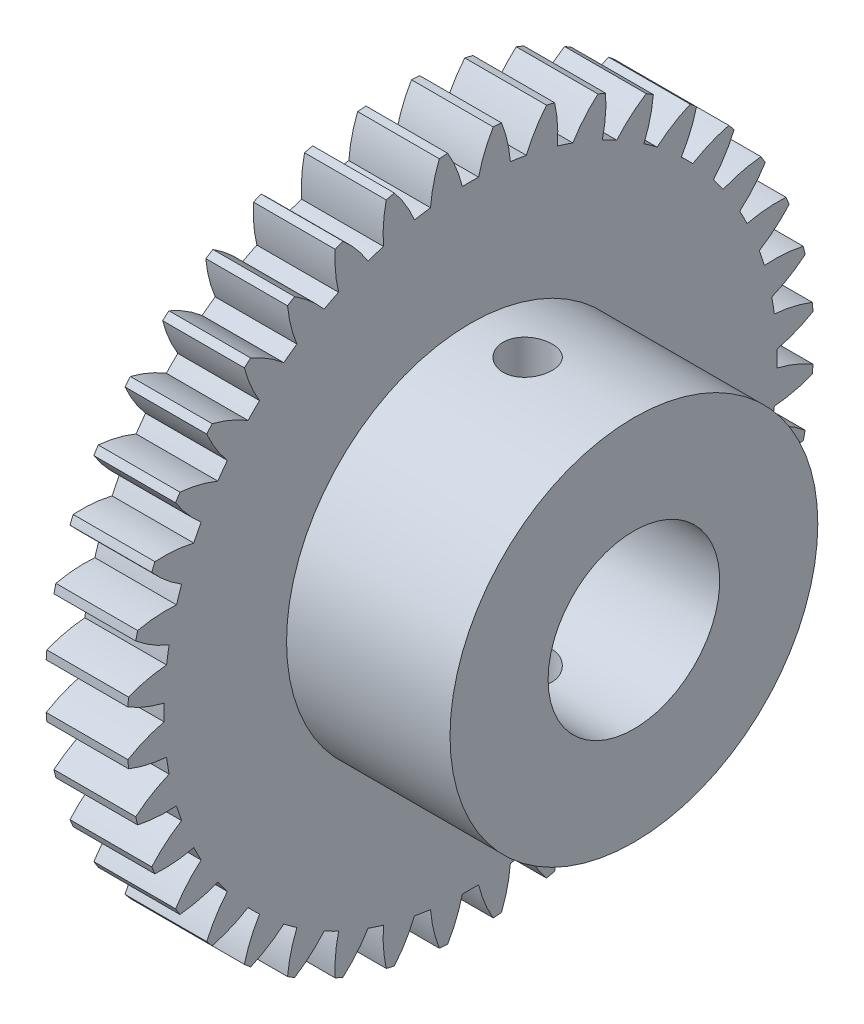
from build123d import *

# Parameters (mm, degrees)
BASPROSKE_W              = 5
BASPROSKE_H              = 21
TOOTHCUT_DEPTH           = 31.116440693
TEETHCUTS_COUNT          = 40
TEETHCUTS_ANGLE          = 351
BORSKE_R                 = 5.25
BORE_DEPTH               = 50.0000508
EXTRUDE_START            = -15
SKETCH_1_R               = 11.25
SKETCH_1_R_2             = 5.25
EXTRUDE_1_DEPTH          = 15
CUT_EXTRUDE_1_DEPTH      = 34.213199913
CUT_EXTRUDE_1_DEPTH_BACK = 34.213199913
SKETCH_2_R               = 1.5


with BuildPart() as part:
    # BasProSke → Base-Revolve (revolve)
    with BuildSketch(Plane(origin=(0, 0, 0), x_dir=(1, 0, 0), z_dir=(0, 1, 0)), mode=Mode.PRIVATE) as base_revolve_sk:
        with Locations((2.5, 10.5)):
            Rectangle(BASPROSKE_W, BASPROSKE_H)
    revolve(base_revolve_sk.sketch.rotate(Axis((-10, 0, 0), (1, 0, 0)), 180), axis=Axis((-10, 0, 0), (1, 0, 0)))

    # TooCutSke → ToothCut (cut, through all)
    with BuildSketch(Plane(origin=(0, 0, 0), x_dir=(0, 0, -1), z_dir=(1, 0, 0))):
        with BuildLine():
            ThreePointArc((0.496262351, 18.74243113), (0, 18.749), (-0.496262351, 18.74243113))
            ThreePointArc((-0.496262351, 18.74243113), (-0.867303271, 19.894912154), (-1.408013778, 20.9782016))
            ThreePointArc((-1.408013778, 20.9782016), (0, 21.0254), (1.408013778, 20.9782016))
            ThreePointArc((1.408013778, 20.9782016), (0.867303271, 19.894912154), (0.496262351, 18.74243113))
        make_face()
    toothcut = extrude(amount=TOOTHCUT_DEPTH, mode=Mode.SUBTRACT)

    # TeethCuts: ToothCut ×40 about axis
    teethcuts_axis = Axis((-10, 0, 0), (1, 0, 0))
    for i in range(1, TEETHCUTS_COUNT):
        add(toothcut.rotate(teethcuts_axis, i * TEETHCUTS_ANGLE / (TEETHCUTS_COUNT - 1)), mode=Mode.SUBTRACT)

    # BorSke → Bore (cut, symmetric)
    with BuildSketch(Plane(origin=(0, 0, 0), x_dir=(0, 0, -1), z_dir=(1, 0, 0))):
        with Locations(Location((0, 0, 0), (0, 0, 180))):
            Circle(BORSKE_R)
    extrude(amount=BORE_DEPTH, both=True, mode=Mode.SUBTRACT)

    # ｽｹｯﾁ1 → ﾎﾞｽ - 押し出し1 (add)
    with BuildSketch(Plane.ZY.offset(EXTRUDE_START)):
        Circle(SKETCH_1_R)
        Circle(SKETCH_1_R_2, mode=Mode.SUBTRACT)
    extrude(amount=EXTRUDE_1_DEPTH)

    # ｽｹｯﾁ2 → ｶｯﾄ - 押し出し1 (cut, two sides: drawn at the far end of the back side and taken through both)
    with BuildSketch(Plane(origin=(0, 0, 0), x_dir=(1, 0, 0), z_dir=(0, 1, 0)).offset(-CUT_EXTRUDE_1_DEPTH_BACK)):
        with Locations(Location((8.5, 0, 0), (0, 0, 270))):
            Circle(SKETCH_2_R)
    extrude(amount=CUT_EXTRUDE_1_DEPTH + CUT_EXTRUDE_1_DEPTH_BACK, mode=Mode.SUBTRACT)


solid = part.part
